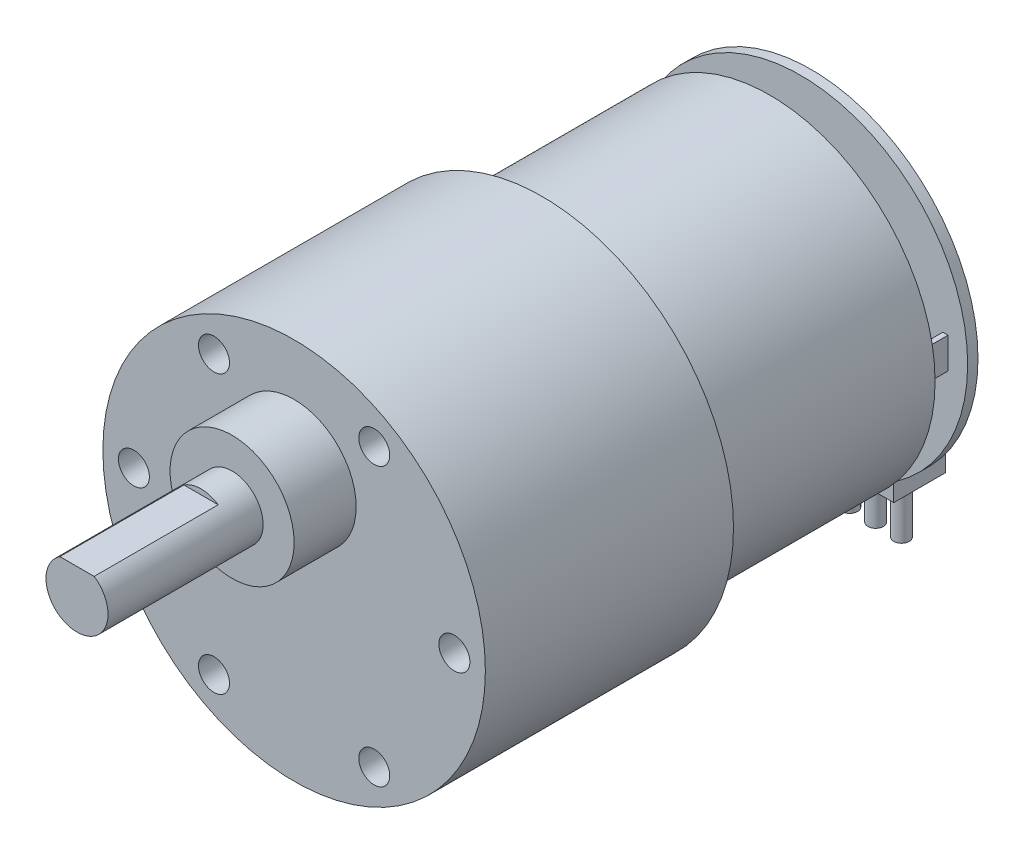
from build123d import *

# Parameters (mm, degrees)
SKETCH_2_R          = 18.5
EXTRUDE_1_DEPTH     = 24
SKETCH_3_R          = 16
EXTRUDE_2_DEPTH     = 22
SKETCH_4_R          = 3
SKETCH_4_W          = 0.5
SKETCH_4_H          = 3
EXTRUDE_3_DEPTH     = 3
SKETCH_5_R          = 16.15
EXTRUDE_4_DEPTH     = 1
SKETCH_6_R          = 6.8
SKETCH_6_W          = 16
SKETCH_6_H          = 9.3
EXTRUDE_7_DEPTH     = 5
SKETCH_7_R          = 0.75
EXTRUDE_8_DEPTH     = 5
SKETCH_8_R          = 6
EXTRUDE_9_DEPTH     = 6
SKETCH_9_R          = 3
EXTRUDE_10_DEPTH    = 15
CUT_EXTRUDE_START   = -12
CUT_EXTRUDE_1_DEPTH = 12
SKETCH_11_R         = 1.5
CUT_EXTRUDE_2_DEPTH = 3.5


with BuildPart() as part:
    # 스케치2 → 보스-돌출1 (new body)
    with BuildSketch(Plane.XY):
        Circle(SKETCH_2_R)
    extrude(amount=-EXTRUDE_1_DEPTH)

    # 스케치3 → 보스-돌출2 (add)
    with BuildSketch(Plane(origin=(0, 0, -24), x_dir=(-1, 0, 0), z_dir=(0, 0, -1))):
        Circle(SKETCH_3_R)
    extrude(amount=EXTRUDE_2_DEPTH)

    # 스케치4 → 보스-돌출3 (add)
    with BuildSketch(Plane(origin=(0, 0, -46), x_dir=(-1, 0, 0), z_dir=(0, 0, -1))):
        Circle(SKETCH_4_R)
        with Locations((14, 0)):
            Rectangle(SKETCH_4_W, SKETCH_4_H)
        with Locations((-14, 0)):
            Rectangle(SKETCH_4_W, SKETCH_4_H)
    extrude(amount=EXTRUDE_3_DEPTH)

    # 스케치5 → 보스-돌출4 (add)
    with BuildSketch(Plane(origin=(0, 0, -49), x_dir=(-1, 0, 0), z_dir=(0, 0, -1))):
        Circle(SKETCH_5_R)
    extrude(amount=EXTRUDE_4_DEPTH)

    # 스케치6 → 보스-돌출7 (add)
    with BuildSketch(Plane(origin=(0, 0, -50), x_dir=(-1, 0, 0), z_dir=(0, 0, -1))):
        Circle(SKETCH_6_R)
        with Locations((0, -11.5)):
            Rectangle(SKETCH_6_W, SKETCH_6_H)
    extrude(amount=EXTRUDE_7_DEPTH)

    # 스케치7 → 보스-돌출8 (add)
    with BuildSketch(Plane.XZ.offset(16.15)):
        with Locations(Location((-6.25, -52.5, 0), (0, 0, 90))):
            Circle(SKETCH_7_R)
        with Locations(Location((-3.75, -52.5, 0), (0, 0, 90))):
            Circle(SKETCH_7_R)
        with Locations(Location((-1.25, -52.5, 0), (0, 0, 90))):
            Circle(SKETCH_7_R)
        with Locations(Location((1.25, -52.5, 0), (0, 0, 90))):
            Circle(SKETCH_7_R)
        with Locations(Location((3.75, -52.5, 0), (0, 0, 90))):
            Circle(SKETCH_7_R)
        with Locations(Location((6.25, -52.5, 0), (0, 0, 90))):
            Circle(SKETCH_7_R)
    extrude(amount=EXTRUDE_8_DEPTH)

    # 스케치8 → 보스-돌출9 (add)
    with BuildSketch(Plane.XY):
        with Locations((0, 7.5)):
            Circle(SKETCH_8_R)
    extrude(amount=EXTRUDE_9_DEPTH)

    # 스케치9 → 보스-돌출10 (add)
    with BuildSketch(Plane.XY.offset(6)):
        with Locations((0, 7.5)):
            Circle(SKETCH_9_R)
    extrude(amount=EXTRUDE_10_DEPTH)

    # 스케치10 → 컷-돌출1 (cut)
    with BuildSketch(Plane.XY.offset(21).offset(CUT_EXTRUDE_START)):
        with BuildLine():
            Line((-1.658312395, 10), (1.658312395, 10))
            ThreePointArc((1.658312395, 10), (0, 10.5), (-1.658312395, 10))
        make_face()
    extrude(amount=CUT_EXTRUDE_1_DEPTH, mode=Mode.SUBTRACT)

    # 스케치11 → 컷-돌출2 (cut)
    with BuildSketch(Plane.XY):
        with Locations((15.5, 0)):
            Circle(SKETCH_11_R)
        with Locations((7.75, -13.423393759)):
            Circle(SKETCH_11_R)
        with Locations((-7.75, -13.423393759)):
            Circle(SKETCH_11_R)
        with Locations((-15.5, 0)):
            Circle(SKETCH_11_R)
        with Locations((-7.75, 13.423393759)):
            Circle(SKETCH_11_R)
        with Locations((7.75, 13.423393759)):
            Circle(SKETCH_11_R)
    extrude(amount=-CUT_EXTRUDE_2_DEPTH, mode=Mode.SUBTRACT)


solid = part.part
